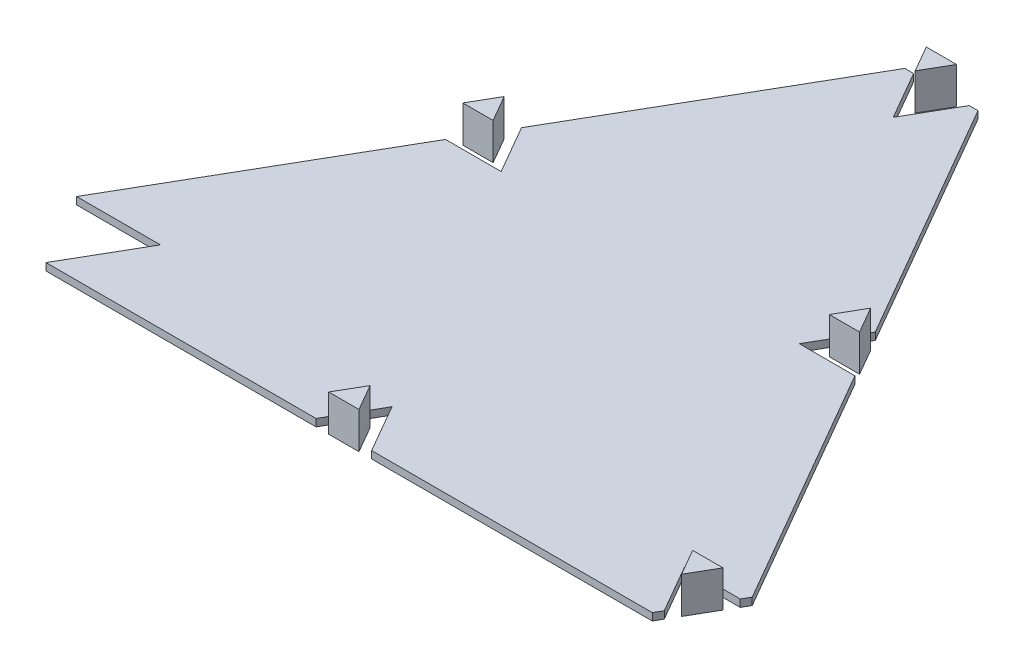
from build123d import *

# Parameters (mm, degrees)
BOSS_EXTRUDE1_DEPTH   = 2
BOSS_EXTRUDE2_DEPTH   = 10
BOSS_EXTRUDE2_2_DEPTH = 10
BOSS_EXTRUDE2_3_DEPTH = 10
BOSS_EXTRUDE2_4_DEPTH = 10
BOSS_EXTRUDE2_5_DEPTH = 10


with BuildPart() as part:
    # Sketch1 → Boss-Extrude1 (new body)
    with BuildSketch(Plane(origin=(0, 0, 0), x_dir=(1, 0, 0), z_dir=(0, 1, 0))):
        Polygon((-92.834192436, 21.392304849), (-55.937822149, 85.298692801), (-40.741669726, 85.298692801), (-48.339745937, 98.458946839), (-9.999999977, 164.865334792), (-7.598076211, 164.865334792), (0, 151.705080754), (7.598076211, 164.865334792), (10.000000007, 164.865334792), (48.33974597, 98.458946834), (40.741669759, 85.298692796), (55.937822182, 85.298692796), (94.277568143, 18.892304841), (93.076606256, 16.812177834), (77.880453952, 16.812177834), (85.478530104, 3.651923899), (84.277568097, 1.571796687), (7.598076284, 1.571796687), (2e-09, 14.732050847), (-7.59807628, 1.571796687), (-81.390816839, 1.571796687), (-69.947441116, 21.392304849), align=None)
    extrude(amount=BOSS_EXTRUDE1_DEPTH)


with BuildPart() as body_2:
    # Sketch1<6> → Boss-Extrude2 (new body)
    with BuildSketch(Plane(origin=(0, 0, 0), x_dir=(1, 0, 0), z_dir=(0, 1, 0))):
        Polygon((-1.2e-07, 8.732050878), (-4.133974466, 1.571796687), (4.133974507, 1.571796687), align=None)
    extrude(amount=BOSS_EXTRUDE2_DEPTH)


with BuildPart() as body_3:
    # Sketch1<6> → Boss-Extrude2 2 (new body)
    with BuildSketch(Plane(origin=(0, 0, 0), x_dir=(1, 0, 0), z_dir=(0, 1, 0))):
        Polygon((91.344555444, 13.812177834), (83.076606252, 13.812177834), (87.210580848, 6.651923796), align=None)
    extrude(amount=BOSS_EXTRUDE2_2_DEPTH)


with BuildPart() as body_4:
    # Sketch1<6> → Boss-Extrude2 3 (new body)
    with BuildSketch(Plane(origin=(0, 0, 0), x_dir=(1, 0, 0), z_dir=(0, 1, 0))):
        Polygon((50.071796778, 95.458946841), (45.937822182, 88.298692803), (54.205771374, 88.298692803), align=None)
    extrude(amount=BOSS_EXTRUDE2_3_DEPTH)


with BuildPart() as body_5:
    # Sketch1<6> → Boss-Extrude2 4 (new body)
    with BuildSketch(Plane(origin=(0, 0, 0), x_dir=(1, 0, 0), z_dir=(0, 1, 0))):
        Polygon((4.133974596, 164.865334799), (-4.133974596, 164.865334799), (0, 157.705080761), align=None)
    extrude(amount=BOSS_EXTRUDE2_4_DEPTH)


with BuildPart() as body_6:
    # Sketch1<6> → Boss-Extrude2 5 (new body)
    with BuildSketch(Plane(origin=(0, 0, 0), x_dir=(1, 0, 0), z_dir=(0, 1, 0))):
        Polygon((-50.071796745, 95.458946839), (-54.205771341, 88.298692801), (-45.937822149, 88.298692801), align=None)
    extrude(amount=BOSS_EXTRUDE2_5_DEPTH)


solid = Compound([part.part, body_2.part, body_3.part, body_4.part, body_5.part, body_6.part])
